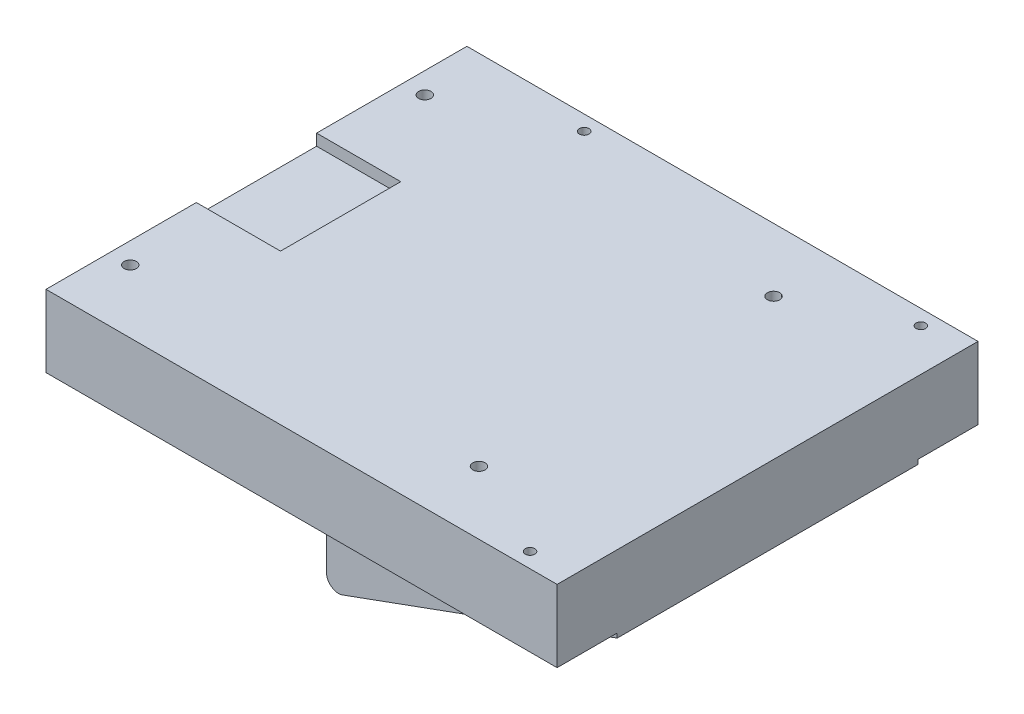
from build123d import *

# Parameters (mm, degrees)
BOSS_EXTRUDE1_DEPTH             = 70
CUT_EXTRUDE1_DEPTH              = 10
CUT_EXTRUDE2_DEPTH              = 10
M2_5_TAPPED_HOLE1_D             = 2.05
M2_5_TAPPED_HOLE1_DEPTH         = 10
M2_5_TAPPED_HOLE1_TIP           = 0.615882135
SKETCH8_W                       = 20
SKETCH8_H                       = 1.89069388
CUT_EXTRUDE3_DEPTH              = 14
M8_TAPPED_HOLE1_D               = 6.8
M8_TAPPED_HOLE1_DEPTH           = 6
M8_TAPPED_HOLE1_TIP             = 2.042926105
M3_TAPPED_HOLE1_D               = 2.5
M3_TAPPED_HOLE1_DEPTH           = 4
M3_TAPPED_HOLE1_TIP             = 0.751075774
M3_TAPPED_HOLE1_ON_FACE_2_D     = 2.5
M3_TAPPED_HOLE1_ON_FACE_2_DEPTH = 4
M3_TAPPED_HOLE1_ON_FACE_2_TIP   = 0.751075774
M2_TAPPED_HOLE1_D               = 1.6
BOSS_EXTRUDE2_DEPTH             = 50
FILLET1_R                       = 2


with BuildPart() as part:
    # Sketch1 → Boss-Extrude1 (new body)
    with BuildSketch(Plane.XY):
        Polygon((-29.059463918, 12.436342138), (-29.059463918, 0.436342138), (-57.250242541, 0.436342138), (-114.059463918, 0.436342138), (-114.059463918, 12.436342138), align=None)
        Polygon((-29.059463918, -0.303053562), (-57.250242541, -10.563657862), (-57.250242541, 0.436342138), (-29.059463918, 0.436342138), align=None)
    extrude(amount=BOSS_EXTRUDE1_DEPTH)

    # Sketch2 → Cut-Extrude1 (cut)
    with BuildSketch(Plane.XY.offset(70)):
        Polygon((-57.250242541, 0.436342138), (-29.059463918, 0.436342138), (-29.059463918, -0.303053562), (-57.250242541, -10.563657862), align=None)
    extrude(amount=-CUT_EXTRUDE1_DEPTH, mode=Mode.SUBTRACT)

    # Sketch3 → Cut-Extrude2 (cut)
    with BuildSketch(Plane(origin=(0, 0, 0), x_dir=(-1, 0, 0), z_dir=(0, 0, -1))):
        Polygon((57.250242541, 0.436342138), (57.250242541, -10.563657862), (29.059463918, -0.303053562), (29.059463918, 0.436342138), align=None)
    extrude(amount=-CUT_EXTRUDE2_DEPTH, mode=Mode.SUBTRACT)

    # M2.5 Tapped Hole1
    with Locations(Plane(origin=(-110.559463918, 12.436342138, 10.5), x_dir=(0, 0, 1), z_dir=(0, 1, 0))):
        with Locations((0, 0), (49, 0), (49, 58), (0, 58)):
            Hole(M2_5_TAPPED_HOLE1_D / 2, depth=M2_5_TAPPED_HOLE1_DEPTH)
            with Locations((0, 0, -(M2_5_TAPPED_HOLE1_DEPTH + M2_5_TAPPED_HOLE1_TIP / 2))):  # 118° drill point
                Cone(0, M2_5_TAPPED_HOLE1_D / 2, M2_5_TAPPED_HOLE1_TIP, mode=Mode.SUBTRACT)

    # Sketch8 → Cut-Extrude3 (cut)
    with BuildSketch(Plane.ZY.offset(114.059463918)):
        with Locations((35, 11.490995198)):
            Rectangle(SKETCH8_W, SKETCH8_H)
    extrude(amount=-CUT_EXTRUDE3_DEPTH, mode=Mode.SUBTRACT)

    # M8 Tapped Hole1
    with Locations(Plane(origin=(-34.697619642, -2.355174422, 35), x_dir=(-0.939692620786, -0.342020143326, 0), z_dir=(0.342020143326, -0.939692620786, 0))):
        with Locations((0, 0)):
            Hole(M8_TAPPED_HOLE1_D / 2, depth=M8_TAPPED_HOLE1_DEPTH)
            with Locations((0, 0, -(M8_TAPPED_HOLE1_DEPTH + M8_TAPPED_HOLE1_TIP / 2))):  # 118° drill point
                Cone(0, M8_TAPPED_HOLE1_D / 2, M8_TAPPED_HOLE1_TIP, mode=Mode.SUBTRACT)

    # M3 Tapped Hole1
    with Locations(Plane(origin=(-46.904584862, -6.798146413, 42.5), x_dir=(-0.939692620786, -0.342020143326, 0), z_dir=(0.342020143326, -0.939692620786, 0))):
        with Locations((0, 0)):
            Hole(M3_TAPPED_HOLE1_D / 2, depth=M3_TAPPED_HOLE1_DEPTH)
            with Locations((0, 0, -(M3_TAPPED_HOLE1_DEPTH + M3_TAPPED_HOLE1_TIP / 2))):  # 118° drill point
                Cone(0, M3_TAPPED_HOLE1_D / 2, M3_TAPPED_HOLE1_TIP, mode=Mode.SUBTRACT)

    # M3 Tapped Hole1 on face 2
    with Locations(Plane(origin=(-46.904584862, -6.798146413, 27.5), x_dir=(-0.939692711209, -0.342019894889, 0), z_dir=(0.342019894889, -0.939692711209, 0))):
        with Locations((0, 0)):
            Hole(M3_TAPPED_HOLE1_ON_FACE_2_D / 2, depth=M3_TAPPED_HOLE1_ON_FACE_2_DEPTH)
            with Locations((0, 0, -(M3_TAPPED_HOLE1_ON_FACE_2_DEPTH + M3_TAPPED_HOLE1_ON_FACE_2_TIP / 2))):  # 118° drill point
                Cone(0, M3_TAPPED_HOLE1_ON_FACE_2_D / 2, M3_TAPPED_HOLE1_ON_FACE_2_TIP, mode=Mode.SUBTRACT)

    # M2 Tapped Hole1 (through all)
    with Locations(Plane(origin=(-36.059463918, 12.436342138, 67.5), x_dir=(0, 0, 1), z_dir=(0, 1, 0))):
        with Locations((0, 0), (-65, 0), (-65, -56)):
            Hole(M2_TAPPED_HOLE1_D / 2)

    # Sketch17 → Boss-Extrude2 (add)
    with BuildSketch(Plane.XY.offset(60)):
        Polygon((-57.250242541, 0.436342138), (-77.407596349, 0.436342138), (-77.407596349, -17.900334649), (-57.250242541, -10.563657862), align=None)
    extrude(amount=-BOSS_EXTRUDE2_DEPTH)

    # Fillet1
    fillet1_edges = [part.edges().sort_by_distance(p)[0] for p in [
        (-77.407596349, -17.900334649, 35),
    ]]
    fillet(fillet1_edges, radius=FILLET1_R)


solid = part.part
